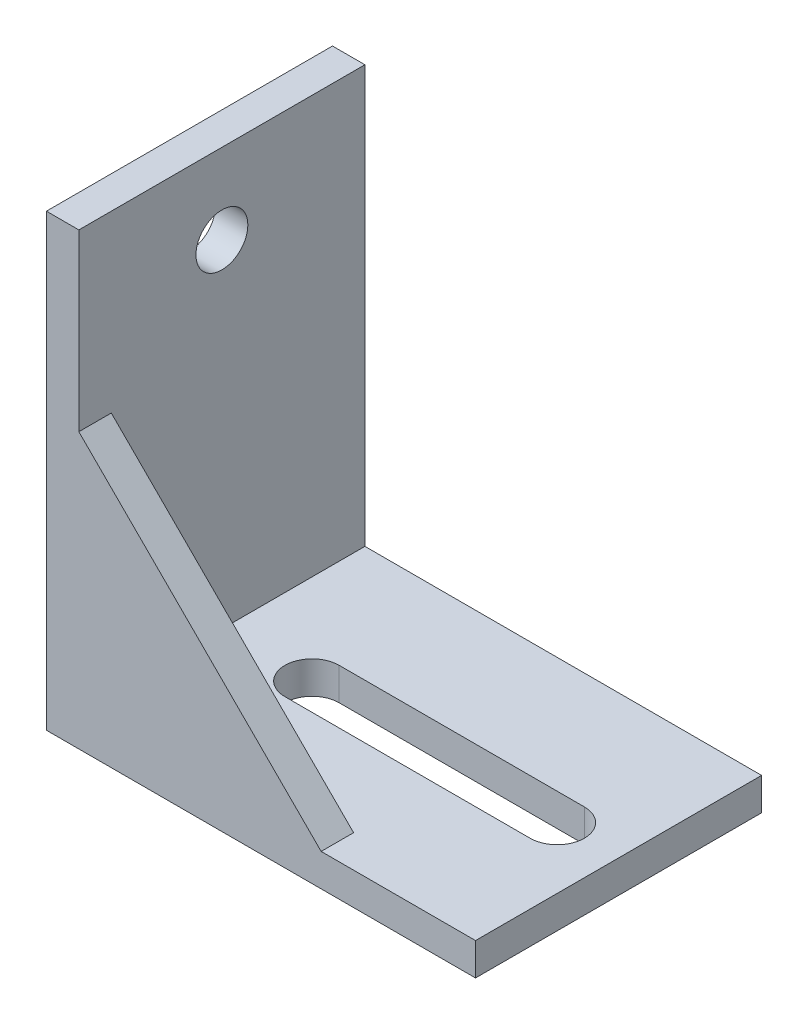
from build123d import *

# Parameters (mm, degrees)
CROQUIS1_W              = 70
CROQUIS1_H              = 110
CROQUIS1_R              = 6.35
SALIENTE_EXTRUIR1_DEPTH = 7.9375
CROQUIS2_W              = 97.0625
CROQUIS2_H              = 70
SALIENTE_EXTRUIR2_DEPTH = 7.9375
SALIENTE_EXTRUIR3_DEPTH = 7.9375


with BuildPart() as part:
    # Croquis1 → Saliente-Extruir1 (new body)
    with BuildSketch(Plane(origin=(0, 0, 0), x_dir=(0, 0, -1), z_dir=(1, 0, 0))):
        with Locations((0, 25)):
            Rectangle(CROQUIS1_W, CROQUIS1_H)
        with Locations((0, 60.378740827)):
            Circle(CROQUIS1_R, mode=Mode.SUBTRACT)
    extrude(amount=SALIENTE_EXTRUIR1_DEPTH)

    # Croquis2 → Saliente-Extruir2 (add)
    with BuildSketch(Plane.XZ.offset(30)):
        with Locations((56.46875, 0)):
            Rectangle(CROQUIS2_W, CROQUIS2_H)
        with BuildLine():
            ThreePointArc((30, -6.640349162), (23.359650838, 0), (30, 6.640349162))
            Line((30, 6.640349162), (90, 6.640349162))
            ThreePointArc((90, 6.640349162), (96.640349162, 0), (90, -6.640349162))
            Line((90, -6.640349162), (30, -6.640349162))
        make_face(mode=Mode.SUBTRACT)
    extrude(amount=-SALIENTE_EXTRUIR2_DEPTH)

    # Croquis3 → Saliente-Extruir3 (add)
    with BuildSketch(Plane(origin=(0, 0, 35), x_dir=(-1, 0, 0), z_dir=(0, 0, -1))):
        Polygon((0, 45.166428926), (-75.166428926, -30), (0, -30), align=None)
    extrude(amount=SALIENTE_EXTRUIR3_DEPTH)


solid = part.part
